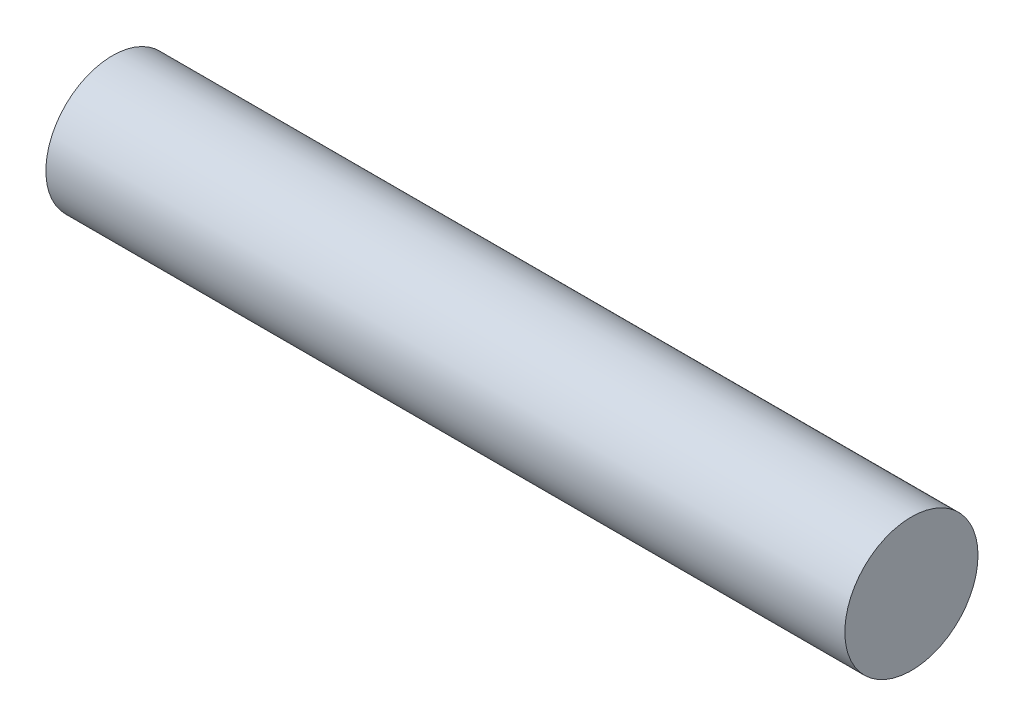
from build123d import *

# Parameters (mm, degrees)
SKETCH2_W = 180
SKETCH2_H = 15


with BuildPart() as part:
    # Sketch2 → Revolve1 (revolve)
    with BuildSketch(Plane.XY, mode=Mode.PRIVATE) as revolve1_sk:
        with Locations((90, 7.5)):
            Rectangle(SKETCH2_W, SKETCH2_H)
    revolve(revolve1_sk.sketch.rotate(Axis((0, 0, 0), (-1, 0, 0)), 90), axis=Axis((0, 0, 0), (-1, 0, 0)))


solid = part.part
